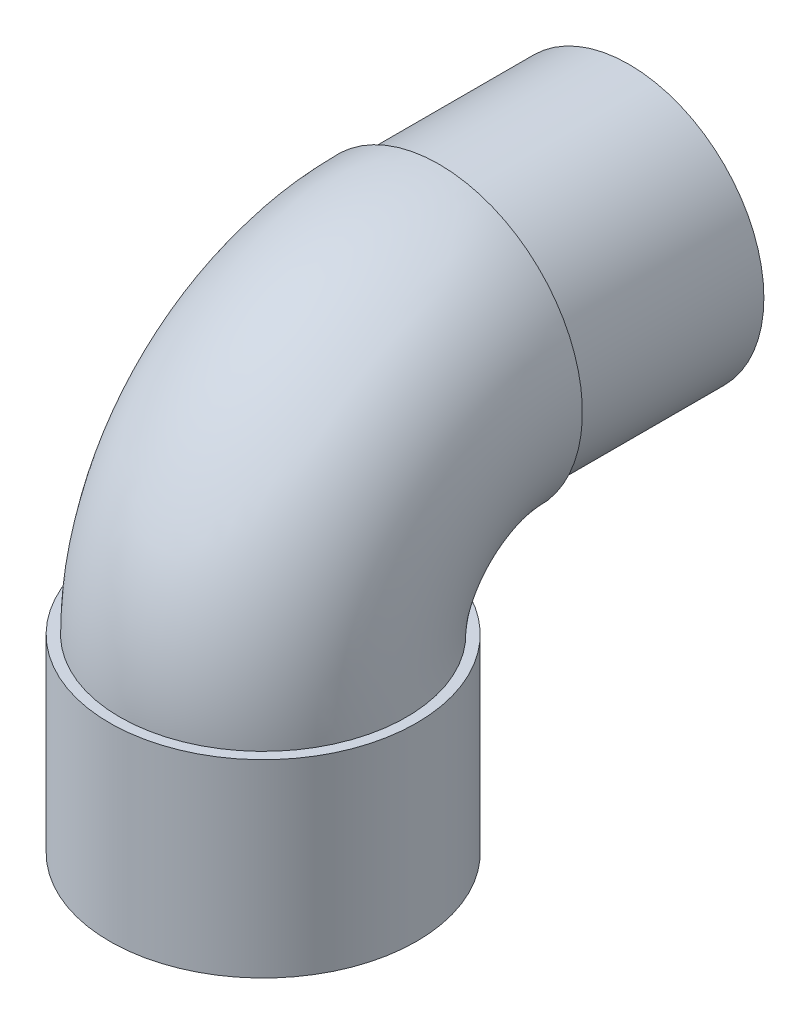
from build123d import *

# Parameters (mm, degrees)
ESQUISSE1_R        = 16.9
ESQUISSE1_R_2      = 13.9
R_VOL_MINCE1_ANGLE = 90
ESQUISSE2_R        = 15.9
ESQUISSE2_R_2      = 13.9
EXTRU_MINCE1_DEPTH = 22.4
ESQUISSE3_R        = 18.1
ESQUISSE3_R_2      = 16.1
EXTRU_MINCE2_DEPTH = 22.3


with BuildPart() as part:
    # Esquisse1 → Révol.-Mince1 (revolve)
    with BuildSketch(Plane.XY):
        Circle(ESQUISSE1_R)
        Circle(ESQUISSE1_R_2, mode=Mode.SUBTRACT)
    revolve(axis=Axis((0, -20.745281933, 0), (1, 0, 0)), revolution_arc=R_VOL_MINCE1_ANGLE)

    # Esquisse2 → Extru.-Mince1 (add)
    with BuildSketch(Plane(origin=(0, 0, 0), x_dir=(-1, 0, 0), z_dir=(0, 0, -1))):
        Circle(ESQUISSE2_R)
        Circle(ESQUISSE2_R_2, mode=Mode.SUBTRACT)
    extrude(amount=EXTRU_MINCE1_DEPTH)

    # Esquisse3 → Extru.-Mince2 (add)
    with BuildSketch(Plane.XZ.offset(20.745281933)):
        with Locations((0, 20.745281933)):
            Circle(ESQUISSE3_R)
        with Locations((0, 20.745281933)):
            Circle(ESQUISSE3_R_2, mode=Mode.SUBTRACT)
    extrude(amount=EXTRU_MINCE2_DEPTH)


solid = part.part
